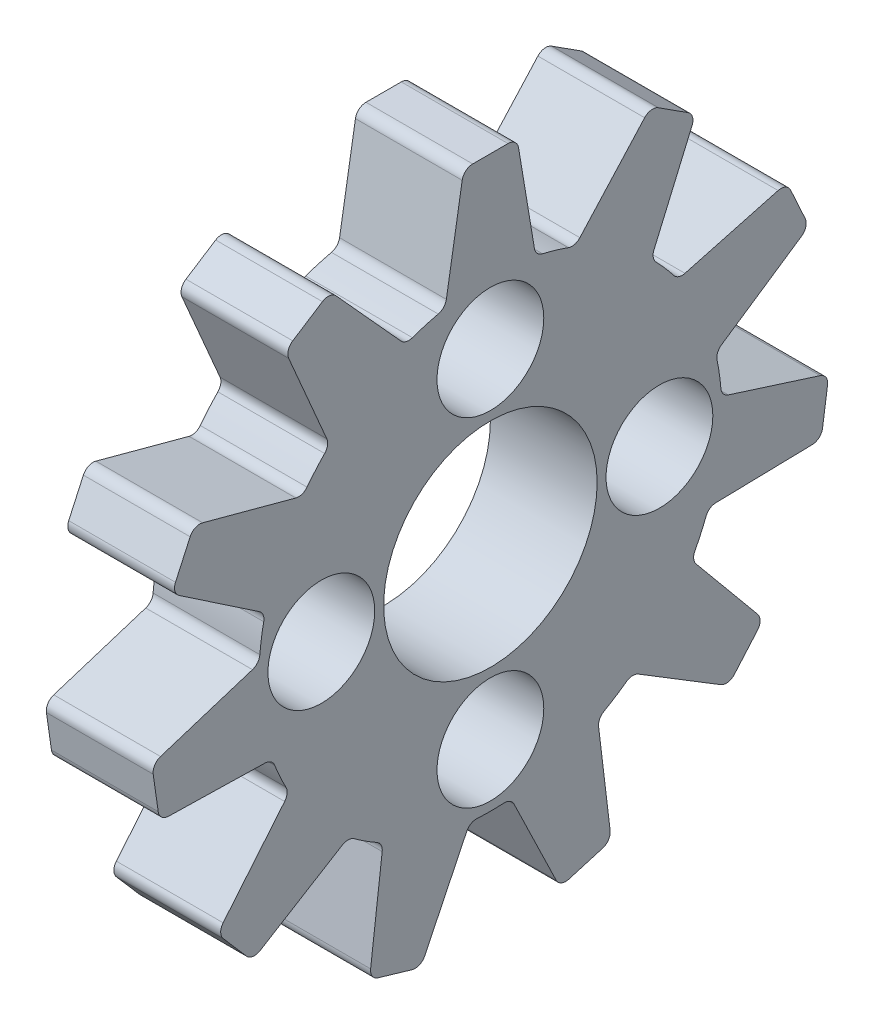
from build123d import *

# Parameters (mm, degrees)
SKETCH9_R                 = 6.5
BOSS_EXTRUDE3_DEPTH       = 3
BOSS_EXTRUDE4_DEPTH       = 3
FILLET9_R                 = 0.3
FILLET10_R                = 0.3
FILLET11_R                = 0.3
FILLET12_R                = 0.3
CIRPATTERN6_COUNT         = 11
FILLET9_OF_CIRPATTERN6_R  = 0.3
FILLET10_OF_CIRPATTERN6_R = 0.3
FILLET11_OF_CIRPATTERN6_R = 0.3
FILLET12_OF_CIRPATTERN6_R = 0.3
SKETCH11_R                = 1.5
CUT_EXTRUDE1_DEPTH        = 3
SKETCH12_R                = 3
CUT_EXTRUDE2_DEPTH        = 3


with BuildPart() as part:
    # Sketch9 → Boss-Extrude3 (new body)
    with BuildSketch(Plane(origin=(0, 0, 0), x_dir=(0, 0, -1), z_dir=(1, 0, 0))):
        Circle(SKETCH9_R)
    extrude(amount=BOSS_EXTRUDE3_DEPTH)

    # Sketch10 → Boss-Extrude4 (add)
    with BuildSketch(Plane(origin=(3, 0, 0), x_dir=(0, 0, -1), z_dir=(1, 0, 0))):
        Polygon((0, 9.5), (0.75, 9.5), (1.5, 5), (0, 5), (-1.5, 5), (-0.75, 9.5), align=None)
    boss_extrude4 = extrude(amount=-BOSS_EXTRUDE4_DEPTH)

    # Fillet9
    fillet9_edges = [part.edges().sort_by_distance(p)[0] for p in [
        (1.5, 9.5, -0.75),
    ]]
    fillet(fillet9_edges, radius=FILLET9_R)

    # Fillet10
    fillet10_edges = [part.edges().sort_by_distance(p)[0] for p in [
        (1.5, 9.5, 0.75),
    ]]
    fillet(fillet10_edges, radius=FILLET10_R)

    # Fillet11
    fillet11_edges = [part.edges().sort_by_distance(p)[0] for p in [
        (1.5, 6.374542236, -1.270909627),
    ]]
    fillet(fillet11_edges, radius=FILLET11_R)

    # Fillet12
    fillet12_edges = [part.edges().sort_by_distance(p)[0] for p in [
        (1.5, 6.374542236, 1.270909627),
    ]]
    fillet(fillet12_edges, radius=FILLET12_R)

    # CirPattern6: Boss-Extrude4 ×11 about axis
    cirpattern6_axis = Axis((0, 0, 0), (1, 0, 0))
    for i in range(1, CIRPATTERN6_COUNT):
        add(boss_extrude4.rotate(cirpattern6_axis, i * 360 / CIRPATTERN6_COUNT))

    # Fillet9 of CirPattern6
    fillet9_of_cirpattern6_edges = [part.edges().sort_by_distance(p)[0] for p in [
        (1.5, 8.397389175, 4.505147616),
        (1.5, 4.62866662, 8.329942696),
        (1.5, -0.609624882, 9.510039827),
        (1.5, -5.654364792, 7.670766507),
        (1.5, -8.903883832, 3.39607902),
        (1.5, -9.326482667, -1.95683956),
        (1.5, -6.787989153, -6.688475406),
        (1.5, -2.094357045, -9.296567569),
        (1.5, 3.264218627, -8.953065216),
        (1.5, 7.586427949, -5.767027915),
    ]]
    fillet(fillet9_of_cirpattern6_edges, radius=FILLET9_OF_CIRPATTERN6_R)

    # Fillet10 of CirPattern6
    fillet10_of_cirpattern6_edges = [part.edges().sort_by_distance(p)[0] for p in [
        (1.5, 7.586427949, 5.767027915),
        (1.5, 3.264218627, 8.953065216),
        (1.5, -2.094357045, 9.296567569),
        (1.5, -6.787989153, 6.688475406),
        (1.5, -9.326482667, 1.95683956),
        (1.5, -8.903883832, -3.39607902),
        (1.5, -5.654364792, -7.670766507),
        (1.5, -0.609624882, -9.510039827),
        (1.5, 4.62866662, -8.329942696),
        (1.5, 8.397389175, -4.505147616),
    ]]
    fillet(fillet10_of_cirpattern6_edges, radius=FILLET10_OF_CIRPATTERN6_R)

    # Fillet11 of CirPattern6
    fillet11_of_cirpattern6_edges = [part.edges().sort_by_distance(p)[0] for p in [
        (1.5, 6.049711796, 2.377180512),
        (1.5, 3.804140606, 5.270532634),
        (1.5, 0.350781652, 6.490527885),
        (1.5, -3.213947997, 5.649826393),
        (1.5, -5.758271867, 3.01534494),
        (1.5, -6.474385104, -0.576487225),
        (1.5, -5.134926817, -3.98528877),
        (1.5, -2.165165547, -6.128789289),
        (1.5, 1.492020486, -6.326442513),
        (1.5, 4.675500556, -4.515494939),
    ]]
    fillet(fillet11_of_cirpattern6_edges, radius=FILLET11_OF_CIRPATTERN6_R)

    # Fillet12 of CirPattern6
    fillet12_of_cirpattern6_edges = [part.edges().sort_by_distance(p)[0] for p in [
        (1.5, 4.675500556, 4.515494939),
        (1.5, 1.492020486, 6.326442513),
        (1.5, -2.165165547, 6.128789289),
        (1.5, -5.134926817, 3.98528877),
        (1.5, -6.474385104, 0.576487225),
        (1.5, -5.758271867, -3.01534494),
        (1.5, -3.213947997, -5.649826393),
        (1.5, 0.350781652, -6.490527885),
        (1.5, 3.804140606, -5.270532634),
        (1.5, 6.049711796, -2.377180512),
    ]]
    fillet(fillet12_of_cirpattern6_edges, radius=FILLET12_OF_CIRPATTERN6_R)

    # Sketch11 → Cut-Extrude1 (cut)
    with BuildSketch(Plane(origin=(3, 0, 0), x_dir=(0, 0, -1), z_dir=(1, 0, 0))):
        with Locations((0, 4.75)):
            Circle(SKETCH11_R)
        with Locations((4.75, 0)):
            Circle(SKETCH11_R)
        with Locations((-4.75, 0)):
            Circle(SKETCH11_R)
        with Locations((0, -4.75)):
            Circle(SKETCH11_R)
    extrude(amount=-CUT_EXTRUDE1_DEPTH, mode=Mode.SUBTRACT)

    # Sketch12 → Cut-Extrude2 (cut)
    with BuildSketch(Plane(origin=(3, 0, 0), x_dir=(0, 0, -1), z_dir=(1, 0, 0))):
        Circle(SKETCH12_R)
    extrude(amount=-CUT_EXTRUDE2_DEPTH, mode=Mode.SUBTRACT)


solid = part.part
